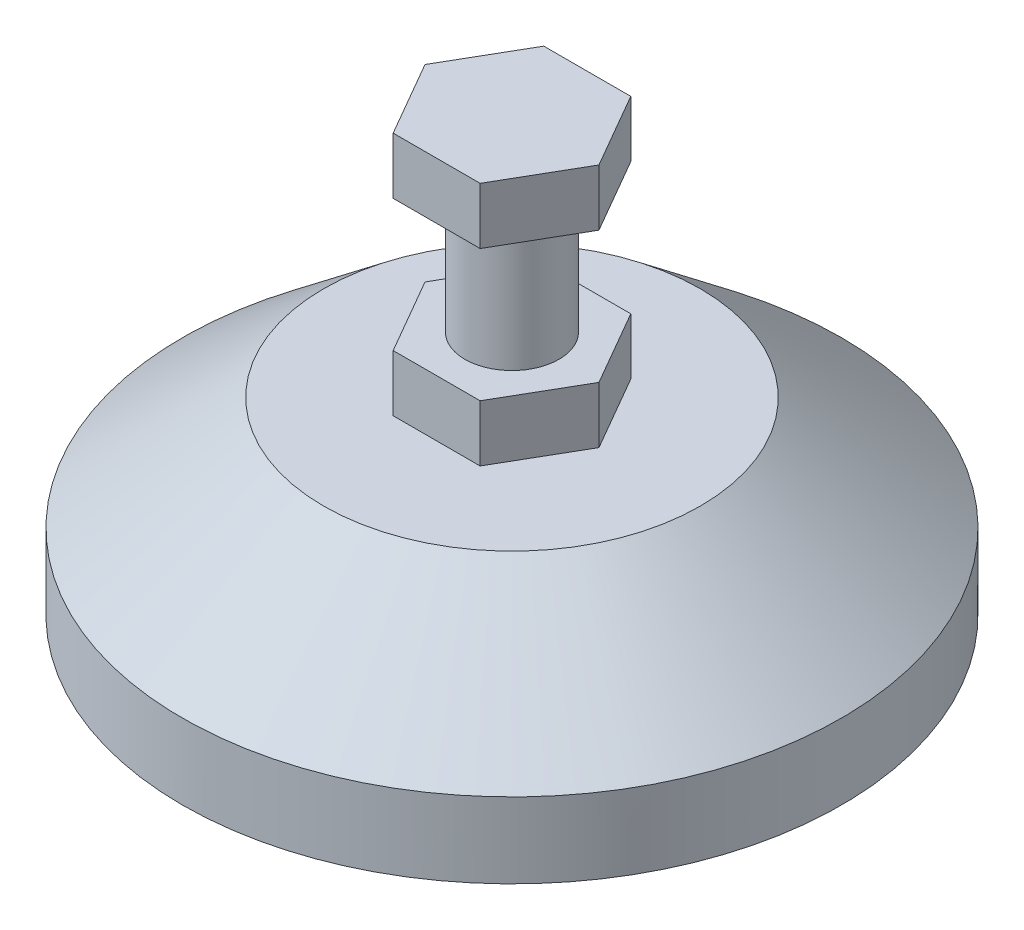
from build123d import *

# Parameters (mm, degrees)
SKETCH_1_R               = 35
EXTRUDE_1_DEPTH          = 8
SKETCH_2_R               = 35
SKETCH_3_R               = 20
EXTRUDE_2_DEPTH          = 6
SKETCH_5_R               = 5
EXTRUDE_3_DEPTH          = 70
CHAMFER_1_SIZE           = 1
CUT_EXTRUDE_1_DEPTH      = 70
CUT_EXTRUDE_1_DEPTH_BACK = 70
SKETCH_6_W               = 71.147706593
SKETCH_6_H               = 64.013654713


with BuildPart() as part:
    # Эскиз1 → Бобышка-Вытянуть1 (new body)
    with BuildSketch(Plane(origin=(0, 0, 0), x_dir=(1, 0, 0), z_dir=(0, 1, 0))):
        with Locations(Location((0, 0, 0), (0, 0, 270))):
            Circle(SKETCH_1_R)
    extrude(amount=EXTRUDE_1_DEPTH)

    # Эскиз2 → По сечениям1 section 0
    with BuildSketch(Plane(origin=(0, 8, 0), x_dir=(1, 0, 0), z_dir=(0, 1, 0))):
        Circle(SKETCH_2_R)
    # Эскиз3 → По сечениям1 section 1
    with BuildSketch(Plane(origin=(0, 20, 0), x_dir=(1, 0, 0), z_dir=(0, 1, 0))):
        Circle(SKETCH_3_R)
    loft()


with BuildPart() as body_2:
    # Эскиз4 → Бобышка-Вытянуть2 (new body)
    with BuildSketch(Plane(origin=(0, 20, 0), x_dir=(1, 0, 0), z_dir=(0, 1, 0))):
        Polygon((9.237604307, 0), (4.618802154, 8), (-4.618802154, 8), (-9.237604307, 0), (-4.618802154, -8), (4.618802154, -8), align=None)
    extrude(amount=EXTRUDE_2_DEPTH)


with BuildPart() as body_3:
    # Эскиз5 → Бобышка-Вытянуть3 (new body)
    with BuildSketch(Plane(origin=(0, 26, 0), x_dir=(1, 0, 0), z_dir=(0, 1, 0))):
        with Locations(Location((0, 0, 0), (0, 0, 270))):
            Circle(SKETCH_5_R)
    extrude(amount=EXTRUDE_3_DEPTH)

    # Фаска1
    chamfer_1_edges = [body_3.edges().sort_by_distance(p)[0] for p in [
        (0, 96, -5),
    ]]
    chamfer(chamfer_1_edges, length=CHAMFER_1_SIZE)

    # Эскиз6 → Вырез-Вытянуть1 (cut, two sides: drawn at the far end of the back side and taken through both)
    with BuildSketch(Plane.XY.offset(-CUT_EXTRUDE_1_DEPTH_BACK)):
        with Locations((2.758972649, 75.006827356)):
            Rectangle(SKETCH_6_W, SKETCH_6_H)
    extrude(amount=CUT_EXTRUDE_1_DEPTH + CUT_EXTRUDE_1_DEPTH_BACK, mode=Mode.SUBTRACT)


with BuildPart() as body_4:
    # Move Body 1: copy of body 2
    add(body_2.part.moved(Location((0, 20, 0))))


solid = Compound([part.part, body_2.part, body_3.part, body_4.part])
